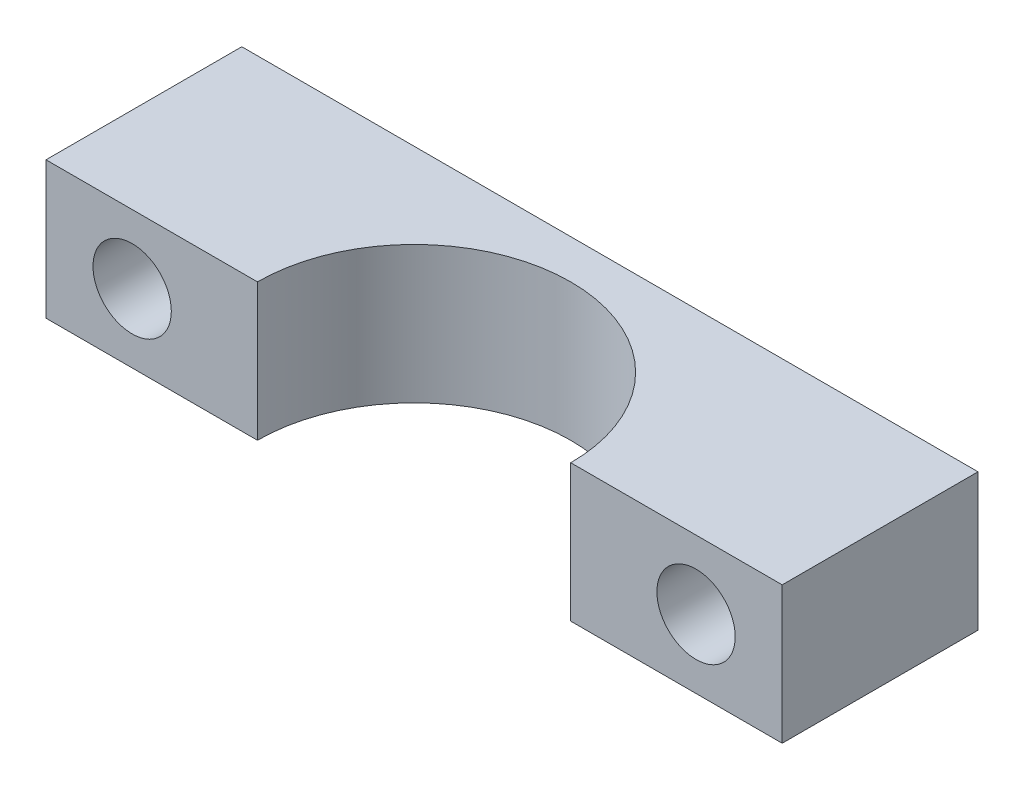
from build123d import *

# Parameters (mm, degrees)
BOSS_EXTRUDE1_DEPTH = 5.5626
SKETCH2_R           = 3.175
CUT_EXTRUDE1_DEPTH  = 35.259045065


with BuildPart() as part:
    # Sketch1 → Boss-Extrude1 (new, symmetric)
    with BuildSketch(Plane(origin=(0, 0, 0), x_dir=(1, 0, 0), z_dir=(0, 1, 0))):
        with BuildLine():
            Line((-12.7, 0), (-29.845, 0))
            Line((-29.845, 0), (-29.845, 15.875))
            Line((-29.845, 15.875), (29.845, 15.875))
            Line((29.845, 15.875), (29.845, 0))
            Line((29.845, 0), (12.7, 0))
            ThreePointArc((12.7, 0), (0, 12.7), (-12.7, 0))
        make_face()
    extrude(amount=BOSS_EXTRUDE1_DEPTH, both=True)

    # Sketch2 → Cut-Extrude1 (cut, through all)
    with BuildSketch(Plane.XY):
        with Locations((-22.86, 0)):
            Circle(SKETCH2_R)
        with Locations((22.86, 0)):
            Circle(SKETCH2_R)
    extrude(amount=-CUT_EXTRUDE1_DEPTH, mode=Mode.SUBTRACT)


solid = part.part
